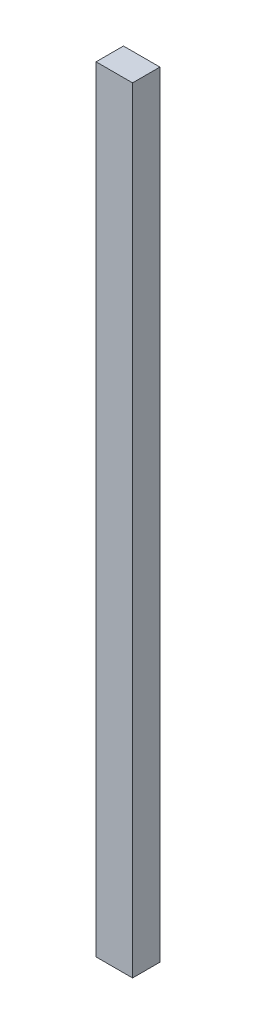
from build123d import *

# Parameters (mm, degrees)
SKETCH_1_W      = 4
SKETCH_1_H      = 85
EXTRUDE_1_DEPTH = 3


with BuildPart() as part:
    # 草图1 → 凸台-拉伸1 (new body)
    with BuildSketch(Plane.XY):
        with Locations((2, 42.5)):
            Rectangle(SKETCH_1_W, SKETCH_1_H)
    extrude(amount=EXTRUDE_1_DEPTH)


solid = part.part
